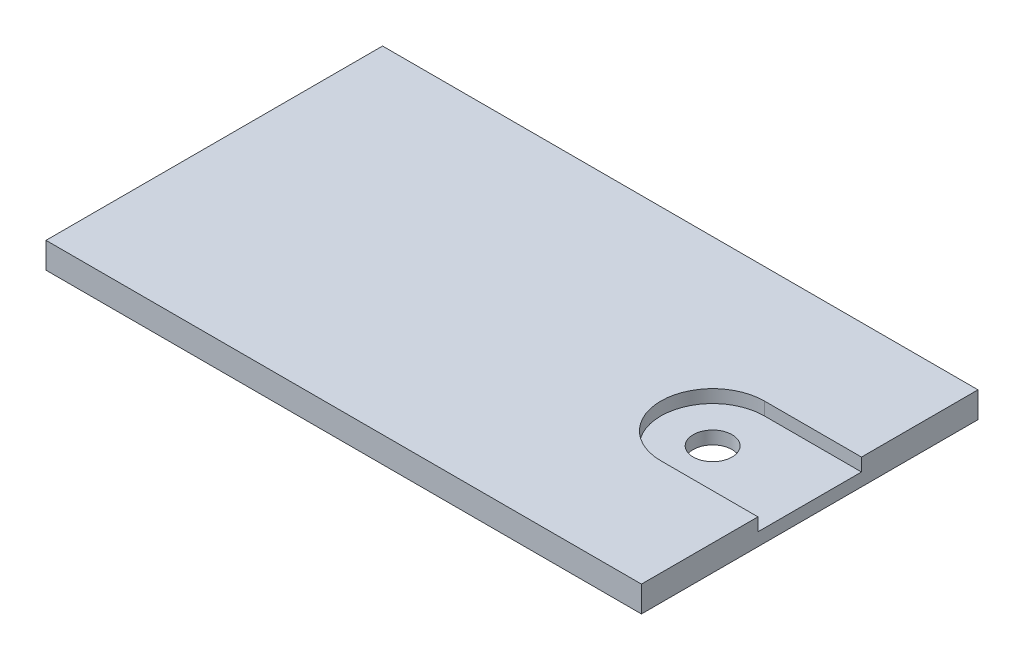
from build123d import *

# Parameters (mm, degrees)
SKETCH1_W                           = 46
SKETCH1_H                           = 26
BOSS_EXTRUDE1_DEPTH                 = 2
CUT_EXTRUDE1_DEPTH                  = 1
F_3_0MM_DOWEL_HOLE1_D               = 3
F_3_0MM_DOWEL_HOLE1_DEPTH           = 1
F_3_0MM_DOWEL_HOLE1_ON_FACE_2_D     = 3
F_3_0MM_DOWEL_HOLE1_ON_FACE_2_DEPTH = 1


with BuildPart() as part:
    # Sketch1 → Boss-Extrude1 (new body)
    with BuildSketch(Plane(origin=(0, 0, 0), x_dir=(1, 0, 0), z_dir=(0, 1, 0))):
        with Locations((23, 13)):
            Rectangle(SKETCH1_W, SKETCH1_H)
    extrude(amount=BOSS_EXTRUDE1_DEPTH)

    # Sketch2 → Cut-Extrude1 (cut)
    with BuildSketch(Plane(origin=(0, 2, 0), x_dir=(1, 0, 0), z_dir=(0, 1, 0))):
        with BuildLine():
            Line((38.5, 17), (53.5, 17))
            ThreePointArc((53.5, 17), (57.5, 13), (53.5, 9))
            Line((53.5, 9), (38.5, 9))
            ThreePointArc((38.5, 9), (34.5, 13), (38.5, 17))
        make_face()
    extrude(amount=-CUT_EXTRUDE1_DEPTH, mode=Mode.SUBTRACT)

    # Ø3.0mm Dowel Hole1
    with Locations(Plane(origin=(38.5, 1, -13), x_dir=(0, 0, 1), z_dir=(0, 1, 0))):
        with Locations((0, 0)):
            Hole(F_3_0MM_DOWEL_HOLE1_D / 2, depth=F_3_0MM_DOWEL_HOLE1_DEPTH)

    # Ø3.0mm Dowel Hole1 on face 2
    with Locations(Plane(origin=(65.15789834, 32.144542586, 0), x_dir=(0, 0, 1), z_dir=(0, 1, 0))):
        with Locations((0, 0)):
            Hole(F_3_0MM_DOWEL_HOLE1_ON_FACE_2_D / 2, depth=F_3_0MM_DOWEL_HOLE1_ON_FACE_2_DEPTH)


solid = part.part
